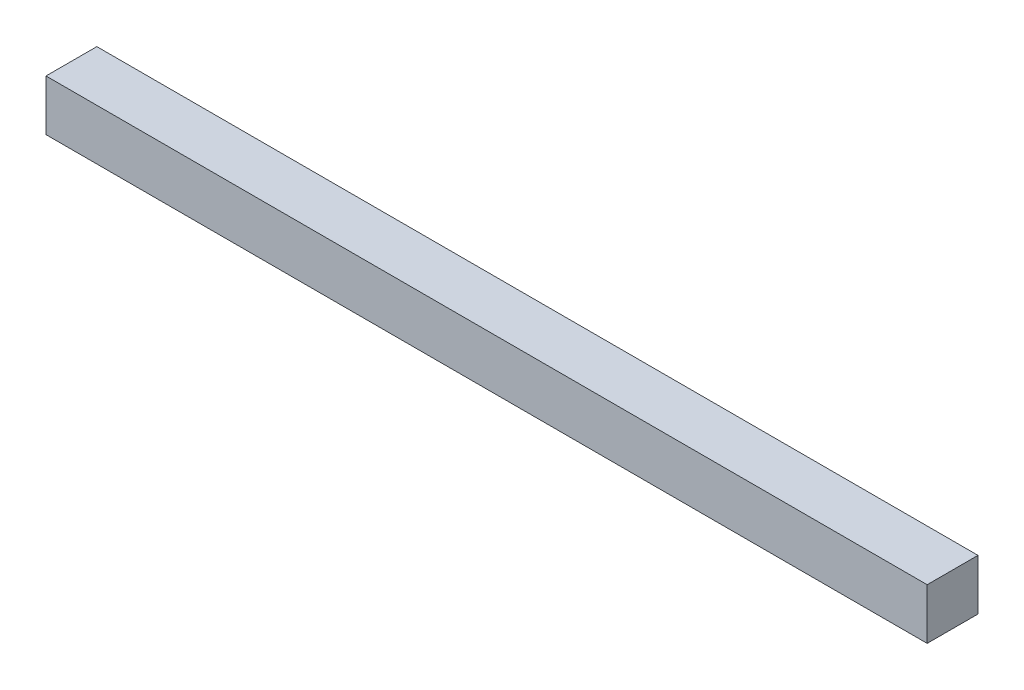
from build123d import *

# Parameters (mm, degrees)
SKETCH1_W           = 260
SKETCH1_H           = 15
BOSS_EXTRUDE3_DEPTH = 15


with BuildPart() as part:
    # Sketch1 → Boss-Extrude3 (new body)
    with BuildSketch(Plane.XY):
        with Locations((129.928272727, 7.506545455)):
            Rectangle(SKETCH1_W, SKETCH1_H)
    extrude(amount=-BOSS_EXTRUDE3_DEPTH)


solid = part.part
